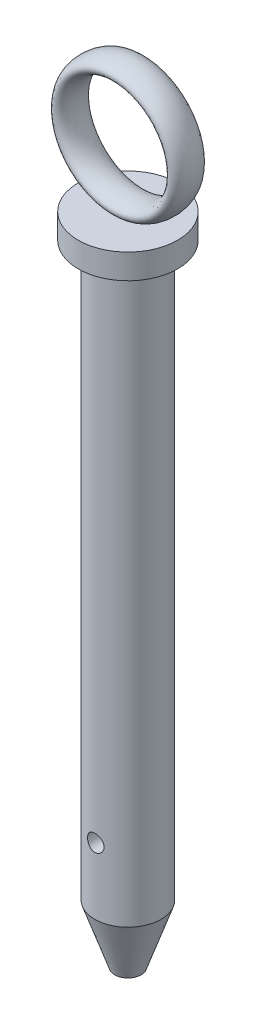
from build123d import *

# Parameters (mm, degrees)
SKETCH_2_R          = 5
CUT_EXTRUDE_1_DEPTH = 401.655712551
SKETCH_3_RX         = 10
SKETCH_3_RY         = 5


with BuildPart() as part:
    # 草图1 → 旋转1 (revolve)
    with BuildSketch(Plane.XY, mode=Mode.PRIVATE) as revolve_1_sk:
        Polygon((0, 0), (0, 395), (-30, 395), (-30, 380), (-20, 380), (-20, 35), (-8, 0), align=None)
    revolve(revolve_1_sk.sketch.rotate(Axis((0, -1000, 0), (0, 1, 0)), 180), axis=Axis((0, -1000, 0), (0, 1, 0)))

    # 草图2 → 切除-拉伸1 (cut, through all)
    with BuildSketch(Plane.XY.offset(30)):
        with Locations((0, 75)):
            Circle(SKETCH_2_R)
    extrude(amount=-CUT_EXTRUDE_1_DEPTH, mode=Mode.SUBTRACT)


with BuildPart() as body_2:
    # 草图3 → 旋转2 (revolve)
    with BuildSketch(Plane(origin=(0, 435, 0), x_dir=(1, 0, 0), z_dir=(0, 1, 0))):
        with Locations(Location((35, 0), (0, 0, -90))):
            Ellipse(SKETCH_3_RX, SKETCH_3_RY)
    revolve(axis=Axis((0, 435, 1000), (0, 0, -1)))


solid = Compound([part.part, body_2.part])
